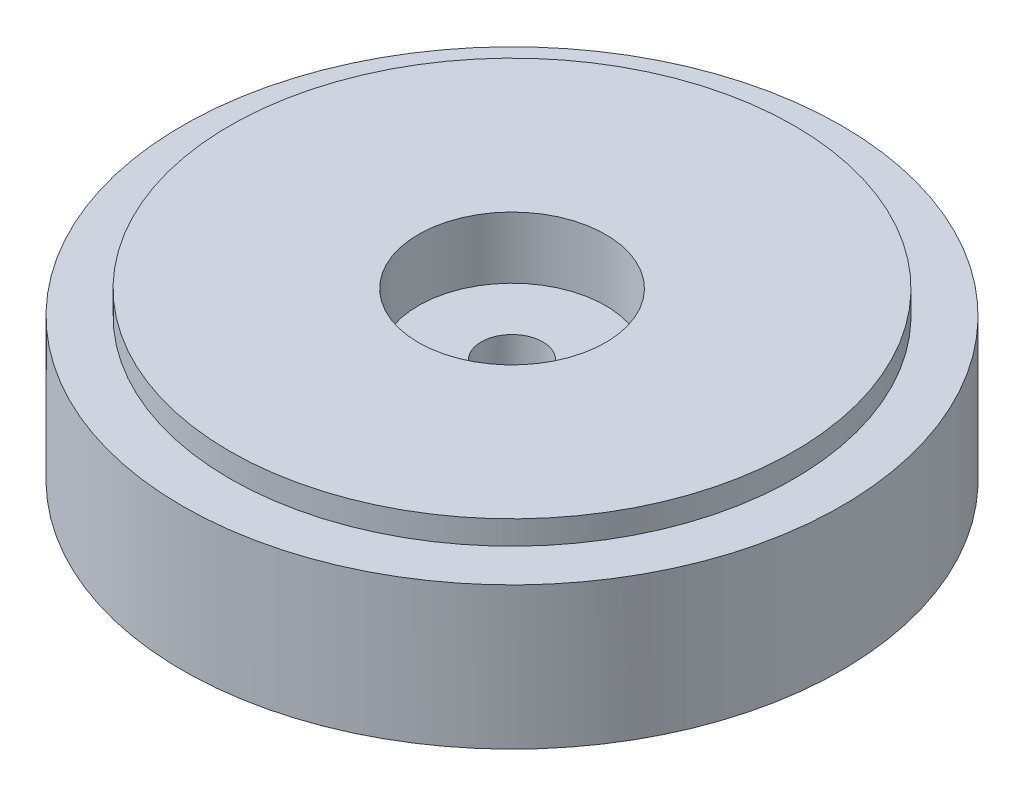
from build123d import *

# Parameters (mm, degrees)
SKETCH1_R           = 69.5
BOSS_EXTRUDE1_DEPTH = 40
CUT_EXTRUDE1_START  = -5
SKETCH2_R           = 69.5
SKETCH2_R_2         = 59.5
CUT_EXTRUDE1_DEPTH  = 5
SKETCH3_R           = 69.5
SKETCH3_R_2         = 59.5
CUT_EXTRUDE2_DEPTH  = 5
SKETCH4_R           = 19.75
CUT_EXTRUDE4_DEPTH  = 13
SKETCH5_R           = 17
BOSS_EXTRUDE2_DEPTH = 8
SKETCH6_R           = 6.5
CUT_EXTRUDE5_DEPTH  = 110.382356895


with BuildPart() as part:
    # Sketch1 → Boss-Extrude1 (new body)
    with BuildSketch(Plane(origin=(0, 0, 0), x_dir=(1, 0, 0), z_dir=(0, 1, 0))):
        with Locations(Location((0, 0, 0), (0, 0, 270))):
            Circle(SKETCH1_R)
    extrude(amount=BOSS_EXTRUDE1_DEPTH)

    # Sketch2 → Cut-Extrude1 (cut)
    with BuildSketch(Plane(origin=(0, 40, 0), x_dir=(1, 0, 0), z_dir=(0, 1, 0)).offset(CUT_EXTRUDE1_START)):
        with Locations(Location((0, 0, 0), (0, 0, 270))):
            Circle(SKETCH2_R)
        with Locations(Location((0, 0, 0), (0, 0, 270))):
            Circle(SKETCH2_R_2, mode=Mode.SUBTRACT)
    extrude(amount=CUT_EXTRUDE1_DEPTH, mode=Mode.SUBTRACT)

    # Sketch3 → Cut-Extrude2 (cut)
    with BuildSketch(Plane.XZ):
        with Locations(Location((0, 0, 0), (0, 0, 270))):
            Circle(SKETCH3_R)
        with Locations(Location((0, 0, 0), (0, 0, 90))):
            Circle(SKETCH3_R_2, mode=Mode.SUBTRACT)
    extrude(amount=-CUT_EXTRUDE2_DEPTH, mode=Mode.SUBTRACT)

    # Sketch4 → Cut-Extrude4 (cut)
    with BuildSketch(Plane(origin=(0, 40, 0), x_dir=(1, 0, 0), z_dir=(0, 1, 0))):
        with Locations(Location((0, 0, 0), (0, 0, 270))):
            Circle(SKETCH4_R)
    extrude(amount=-CUT_EXTRUDE4_DEPTH, mode=Mode.SUBTRACT)

    # Sketch5 → Boss-Extrude2 (add)
    with BuildSketch(Plane.XZ):
        with Locations(Location((0, 0, 0), (0, 0, 270))):
            Circle(SKETCH5_R)
    extrude(amount=BOSS_EXTRUDE2_DEPTH)

    # Sketch6 → Cut-Extrude5 (cut, through all)
    with BuildSketch(Plane.XZ.offset(8)):
        with Locations(Location((0, 0, 0), (0, 0, 270))):
            Circle(SKETCH6_R)
    extrude(amount=-CUT_EXTRUDE5_DEPTH, mode=Mode.SUBTRACT)


solid = part.part
